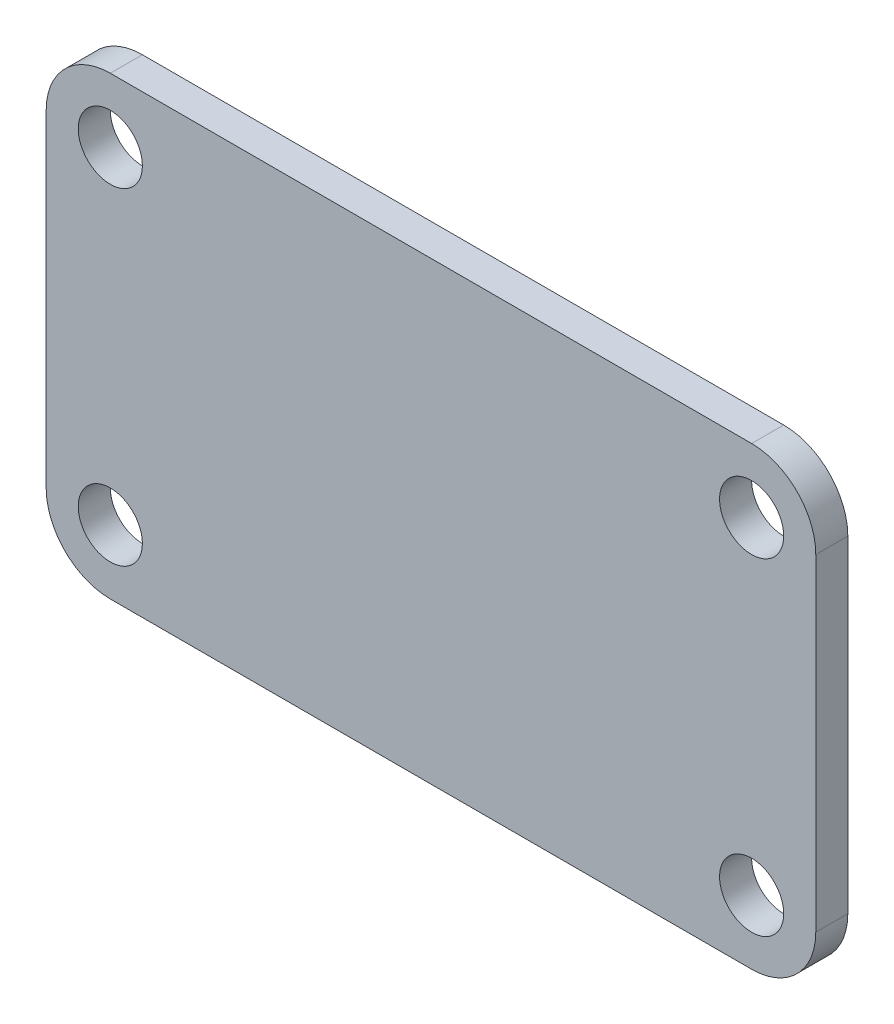
from build123d import *

# Parameters (mm, degrees)
SKETCH1_W           = 30.48
SKETCH1_H           = 18.034
SKETCH1_R           = 1.27
BOSS_EXTRUDE1_DEPTH = 1.27
FILLET1_R           = 2.54


with BuildPart() as part:
    # Sketch1 → Boss-Extrude1 (new body)
    with BuildSketch(Plane.XY):
        with Locations((12.7, 6.477)):
            Rectangle(SKETCH1_W, SKETCH1_H)
        with Locations((0, 12.954)):
            Circle(SKETCH1_R, mode=Mode.SUBTRACT)
        Circle(SKETCH1_R, mode=Mode.SUBTRACT)
        with Locations((25.4, 12.954)):
            Circle(SKETCH1_R, mode=Mode.SUBTRACT)
        with Locations((25.4, 0)):
            Circle(SKETCH1_R, mode=Mode.SUBTRACT)
    extrude(amount=BOSS_EXTRUDE1_DEPTH)

    # Fillet1
    fillet1_edges = [part.edges().sort_by_distance(p)[0] for p in [
        (27.94, 15.494, 0.635),
        (27.94, -2.54, 0.635),
        (-2.54, -2.54, 0.635),
        (-2.54, 15.494, 0.635),
    ]]
    fillet(fillet1_edges, radius=FILLET1_R)


solid = part.part
